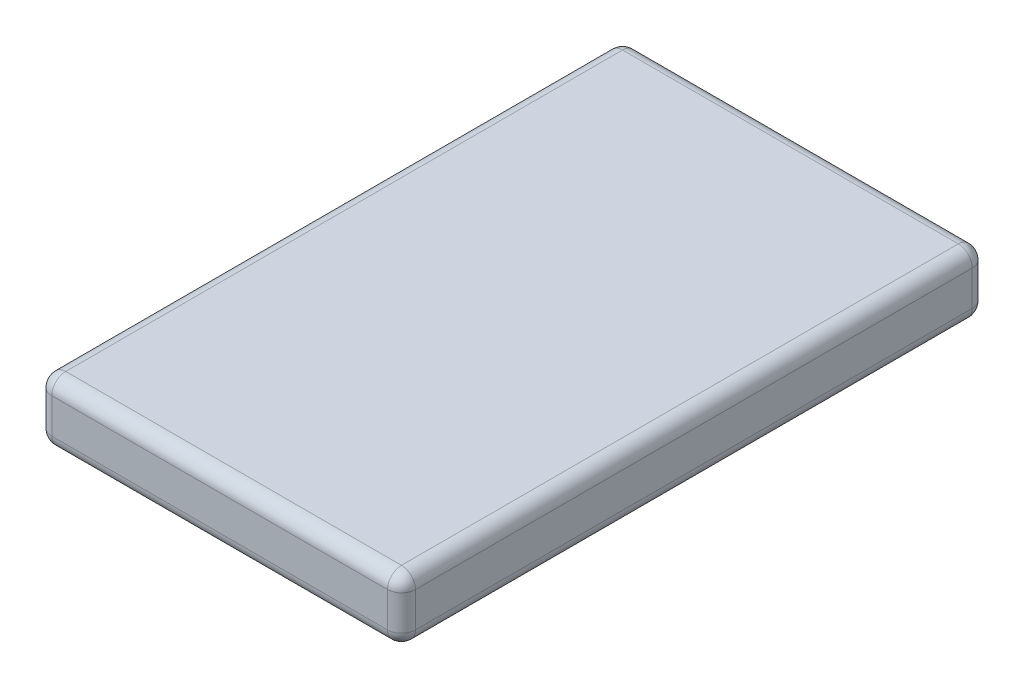
from build123d import *

# Parameters (mm, degrees)
SKETCH1_W           = 33.02
SKETCH1_H           = 53.086
BOSS_EXTRUDE1_DEPTH = 5.715
FILLET1_R           = 1.27


with BuildPart() as part:
    # Sketch1 → Boss-Extrude1 (new body)
    with BuildSketch(Plane(origin=(0, 0, 0), x_dir=(1, 0, 0), z_dir=(0, 1, 0))):
        Rectangle(SKETCH1_W, SKETCH1_H)
    extrude(amount=BOSS_EXTRUDE1_DEPTH)

    # Fillet1
    fillet1_edges = [part.edges().sort_by_distance(p)[0] for p in [
        (-16.51, 5.715, 0),
        (0, 5.715, 26.543),
        (16.51, 5.715, 0),
        (0, 0, 26.543),
        (-16.51, 0, 0),
        (0, 0, -26.543),
        (16.51, 0, 0),
        (0, 5.715, -26.543),
        (16.51, 2.8575, 26.543),
        (-16.51, 2.8575, 26.543),
        (-16.51, 2.8575, -26.543),
        (16.51, 2.8575, -26.543),
    ]]
    fillet(fillet1_edges, radius=FILLET1_R)


solid = part.part
